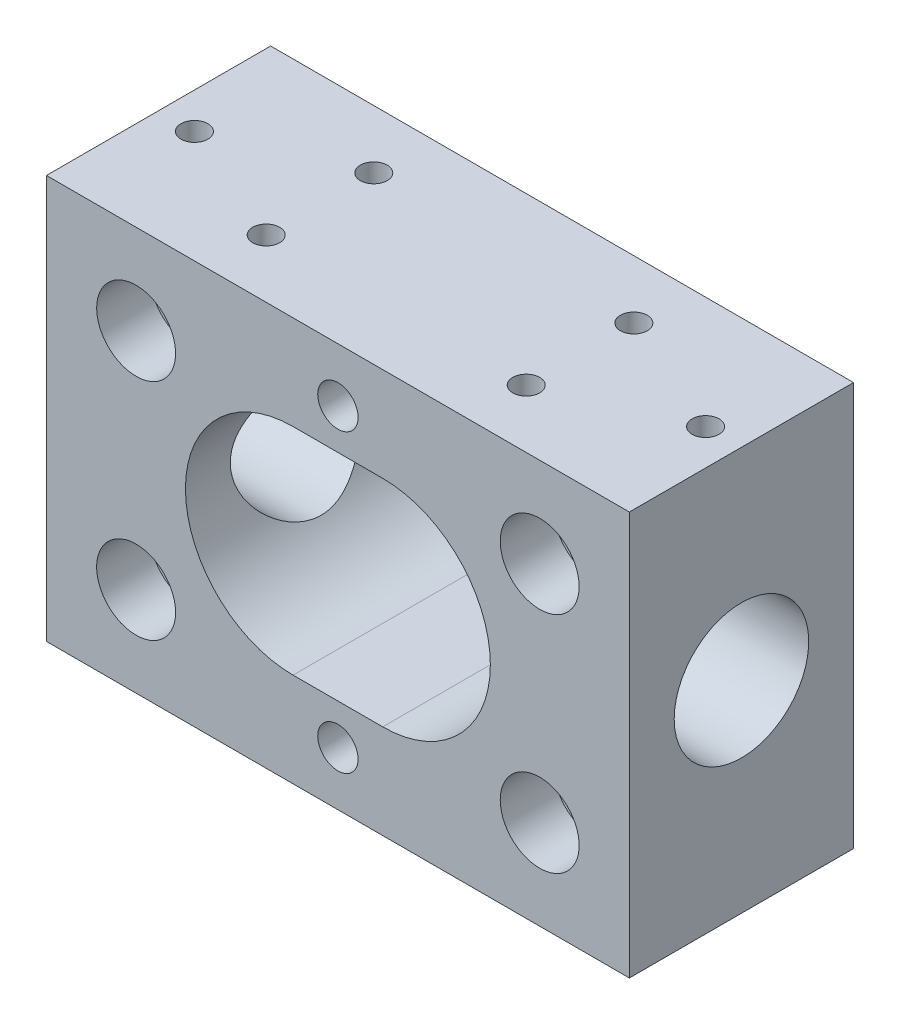
from build123d import *

# Parameters (mm, degrees)
SCHIZZO1_W                                           = 65
SCHIZZO1_H                                           = 45
ESTRUSIONE_ESTRUSIONE1_DEPTH                         = 25
SCHIZZO2_R                                           = 7.5
TAGLIO_ESTRUSIONE1_DEPTH                             = 83.915619759
FORO_LAMATO_PER_VITE_M4_A_TESTA_CILINDRI_D           = 4.5
FORO_LAMATO_PER_VITE_M4_A_TESTA_CILINDRI_CBORE_D     = 8
FORO_LAMATO_PER_VITE_M4_A_TESTA_CILINDRI_CBORE_DEPTH = 2.6
TAGLIO_ESTRUSIONE4_DEPTH                             = 83.915619759
SCHIZZO15_R                                          = 4.4
TAGLIO_ESTRUSIONE5_DEPTH                             = 6
SCHIZZO16_R                                          = 3
TAGLIO_ESTRUSIONE6_DEPTH                             = 82.308056285
SCHIZZO17_R                                          = 5
TAGLIO_ESTRUSIONE8_DEPTH                             = 10
FORO_3_0_3_1_D                                       = 3
FORO_3_0_3_1_DEPTH                                   = 12
FORO_3_0_3_1_TIP                                     = 0.901290929
FORO_3_0_3_2_D                                       = 3
FORO_3_0_3_2_DEPTH                                   = 12
FORO_3_0_3_2_TIP                                     = 0.901290929
FORO_3_0_3_3_D                                       = 3
FORO_3_0_3_3_DEPTH                                   = 12
FORO_3_0_3_3_TIP                                     = 0.901290929


with BuildPart() as part:
    # Schizzo1 → Estrusione-Estrusione1 (new body)
    with BuildSketch(Plane.XY):
        with Locations((32.5, 22.5)):
            Rectangle(SCHIZZO1_W, SCHIZZO1_H)
    extrude(amount=-ESTRUSIONE_ESTRUSIONE1_DEPTH)

    # Schizzo2 → Taglio-Estrusione1 (cut, through all)
    with BuildSketch(Plane.ZY):
        with Locations((-12.5, 22.5)):
            Circle(SCHIZZO2_R)
    extrude(amount=-TAGLIO_ESTRUSIONE1_DEPTH, mode=Mode.SUBTRACT)

    # Foro lamato per Vite M4 a testa cilindrica piana-1 (through all)
    with Locations(Plane(origin=(32.5, 39, -25), x_dir=(-1, 0, 0), z_dir=(0, 0, -1))):
        with Locations((0, 0), (0, -33)):
            CounterBoreHole(FORO_LAMATO_PER_VITE_M4_A_TESTA_CILINDRI_D / 2, FORO_LAMATO_PER_VITE_M4_A_TESTA_CILINDRI_CBORE_D / 2, FORO_LAMATO_PER_VITE_M4_A_TESTA_CILINDRI_CBORE_DEPTH)

    # Schizzo14 → Taglio-Estrusione4 (cut, through all)
    with BuildSketch(Plane.XY):
        with BuildLine():
            Line((37.5, 10.5), (27.5, 10.5))
            ThreePointArc((27.5, 10.5), (15.5, 22.5), (27.5, 34.5))
            Line((27.5, 34.5), (37.5, 34.5))
            ThreePointArc((37.5, 34.5), (49.5, 22.5), (37.5, 10.5))
        make_face()
    extrude(amount=-TAGLIO_ESTRUSIONE4_DEPTH, mode=Mode.SUBTRACT)

    # Schizzo15 → Taglio-Estrusione5 (cut)
    with BuildSketch(Plane.XY):
        with Locations((10, 10)):
            Circle(SCHIZZO15_R)
        with Locations((55, 10)):
            Circle(SCHIZZO15_R)
        with Locations((55, 35)):
            Circle(SCHIZZO15_R)
        with Locations((10, 35)):
            Circle(SCHIZZO15_R)
    extrude(amount=-TAGLIO_ESTRUSIONE5_DEPTH, mode=Mode.SUBTRACT)

    # Schizzo16 → Taglio-Estrusione6 (cut, through all)
    with BuildSketch(Plane.XY.offset(-6)):
        with Locations((10, 10)):
            Circle(SCHIZZO16_R)
        with Locations((55, 10)):
            Circle(SCHIZZO16_R)
        with Locations((55, 35)):
            Circle(SCHIZZO16_R)
        with Locations((10, 35)):
            Circle(SCHIZZO16_R)
    extrude(amount=-TAGLIO_ESTRUSIONE6_DEPTH, mode=Mode.SUBTRACT)

    # Schizzo17 → Taglio-Estrusione8 (cut)
    with BuildSketch(Plane(origin=(0, 0, -25), x_dir=(-1, 0, 0), z_dir=(0, 0, -1))):
        with Locations((-10, 10)):
            Circle(SCHIZZO17_R)
        with Locations((-55, 10)):
            Circle(SCHIZZO17_R)
        with Locations((-55, 35)):
            Circle(SCHIZZO17_R)
        with Locations((-10, 35)):
            Circle(SCHIZZO17_R)
    extrude(amount=-TAGLIO_ESTRUSIONE8_DEPTH, mode=Mode.SUBTRACT)

    # Foro Ø3.0 (3)-1
    with Locations(Plane(origin=(18, 45, -18.5), x_dir=(0, 0, 1), z_dir=(0, 1, 0))):
        with Locations((0, 0), (12, 0), (6, -14), (0, 29), (12, 29), (6, 43)):
            Hole(FORO_3_0_3_1_D / 2, depth=FORO_3_0_3_1_DEPTH)
            with Locations((0, 0, -(FORO_3_0_3_1_DEPTH + FORO_3_0_3_1_TIP / 2))):  # 118° drill point
                Cone(0, FORO_3_0_3_1_D / 2, FORO_3_0_3_1_TIP, mode=Mode.SUBTRACT)

    # Foro Ø3.0 (3)-2
    with Locations(Plane(origin=(18, 0, -6.5), x_dir=(0, 0, -1), z_dir=(0, -1, 0))):
        with Locations((0, 0), (6, -14), (12, 0), (0, 29), (12, 29), (6, 43)):
            Hole(FORO_3_0_3_2_D / 2, depth=FORO_3_0_3_2_DEPTH)
            with Locations((0, 0, -(FORO_3_0_3_2_DEPTH + FORO_3_0_3_2_TIP / 2))):  # 118° drill point
                Cone(0, FORO_3_0_3_2_D / 2, FORO_3_0_3_2_TIP, mode=Mode.SUBTRACT)

    # Foro Ø3.0 (3)-3
    with Locations(Plane(origin=(0, 41, -20), x_dir=(0, 0, -1), z_dir=(-1, 0, 0))):
        with Locations((0, 0), (0, 37)):
            Hole(FORO_3_0_3_3_D / 2, depth=FORO_3_0_3_3_DEPTH)
            with Locations((0, 0, -(FORO_3_0_3_3_DEPTH + FORO_3_0_3_3_TIP / 2))):  # 118° drill point
                Cone(0, FORO_3_0_3_3_D / 2, FORO_3_0_3_3_TIP, mode=Mode.SUBTRACT)


solid = part.part
